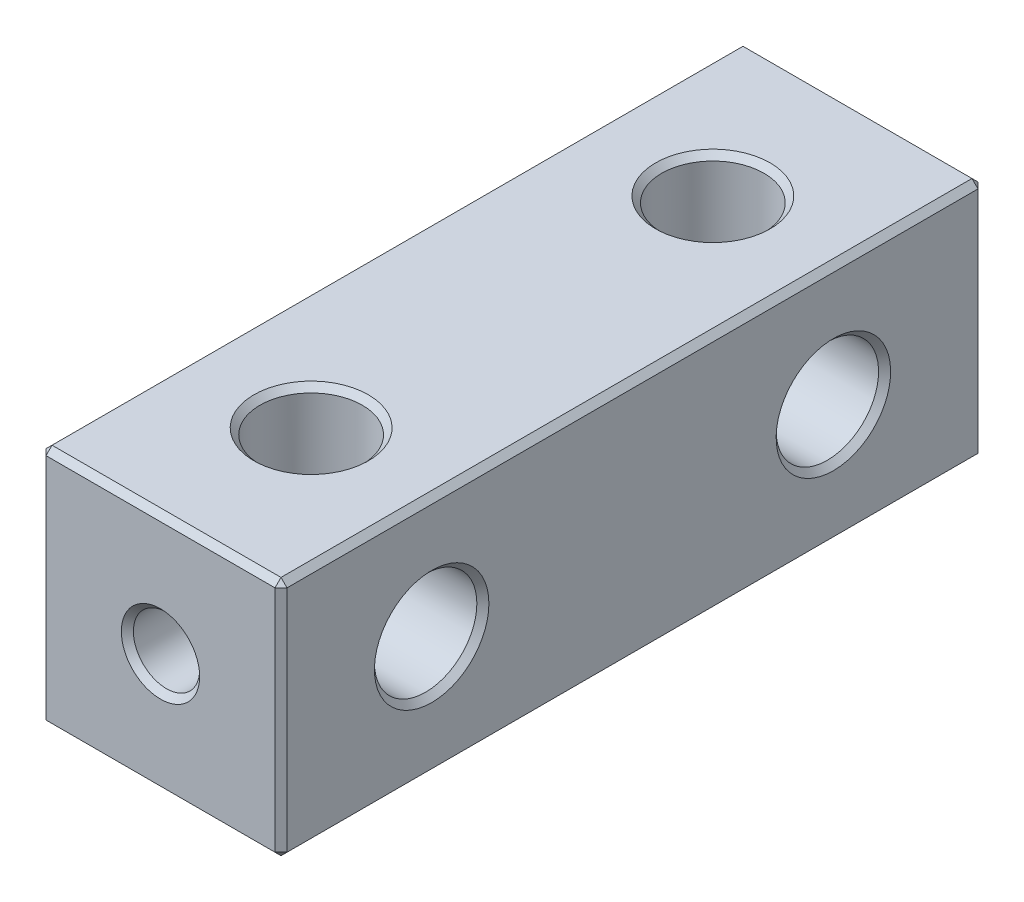
from build123d import *

# Parameters (mm, degrees)
SKETCH_1_W              = 12
SKETCH_1_H              = 12
EXTRUDE_1_DEPTH         = 17.5
HOLE_WIZARD_5_1_5_1_1_D = 5.1
HOLE_WIZARD_5_1_5_1_2_D = 5.1
HOLE_WIZARD_M4_1_REACH  = 38.014
HOLE_WIZARD_M4_1_BORE_R = 1.65
HOLE_WIZARD_M4_2_REACH  = 38.014
HOLE_WIZARD_M4_2_BORE_R = 1.65
CHAMFER_1_SIZE          = 0.3


with BuildPart() as part:
    # 草图1 → 凸台-拉伸1 (new, symmetric)
    with BuildSketch(Plane.XY):
        Rectangle(SKETCH_1_W, SKETCH_1_H)
    extrude(amount=EXTRUDE_1_DEPTH, both=True)

    # Ø5.1 (5.1) 直径孔1 (through all)
    with Locations(Plane(origin=(6, 0, 0), x_dir=(0, 0, -1), z_dir=(1, 0, 0))):
        with Locations((-10, 0), (10, 0)):
            Hole(HOLE_WIZARD_5_1_5_1_1_D / 2)

    # Ø5.1 (5.1) 直径孔2 (through all)
    with Locations(Plane(origin=(0, 6, 0), x_dir=(1, 0, 0), z_dir=(0, 1, 0))):
        with Locations((0, -10), (0, 10)):
            Hole(HOLE_WIZARD_5_1_5_1_2_D / 2)

    # M4 螺纹孔1 bore → M4 螺纹孔1 (cut, up to next)
    with BuildSketch(Plane.XY.offset(17.5), mode=Mode.PRIVATE) as hole_wizard_m4_1_sk1:
        Circle(HOLE_WIZARD_M4_1_BORE_R)
    hole_wizard_m4_1_tool1 = extrude(hole_wizard_m4_1_sk1.sketch, amount=-HOLE_WIZARD_M4_1_REACH, mode=Mode.PRIVATE) & part.part
    add(hole_wizard_m4_1_tool1.solids().sort_by_distance((0, 0, 17.5))[0], mode=Mode.SUBTRACT)

    # M4 螺纹孔2 bore → M4 螺纹孔2 (cut, up to next)
    with BuildSketch(Plane(origin=(0, 0, -17.5), x_dir=(-1, 0, 0), z_dir=(0, 0, -1)), mode=Mode.PRIVATE) as hole_wizard_m4_2_sk1:
        Circle(HOLE_WIZARD_M4_2_BORE_R)
    hole_wizard_m4_2_tool1 = extrude(hole_wizard_m4_2_sk1.sketch, amount=-HOLE_WIZARD_M4_2_REACH, mode=Mode.PRIVATE) & part.part
    add(hole_wizard_m4_2_tool1.solids().sort_by_distance((0, 0, -17.5))[0], mode=Mode.SUBTRACT)

    # 倒角1
    chamfer_1_edges = [part.edges().sort_by_distance(p)[0] for p in [
        (-6, 0, 17.5),
        (6, 0, -12.55),
        (-6, 0, -12.55),
        (0, -6, 17.5),
        (6, 0, 7.45),
        (-6, 0, 7.45),
        (2.55, -6, -10),
        (2.55, 6, -10),
        (2.55, -6, 10),
        (2.55, 6, 10),
        (6, 0, 17.5),
        (0, -6, -17.5),
        (-6, 0, -17.5),
        (-1.65, 0, 17.5),
        (0, 6, -17.5),
        (6, 0, -17.5),
        (1.65, 0, -17.5),
        (6, -6, 0),
        (-6, -6, 0),
        (-6, 6, 0),
        (6, 6, 0),
        (0, 6, 17.5),
    ]]
    chamfer(chamfer_1_edges, length=CHAMFER_1_SIZE)


solid = part.part
